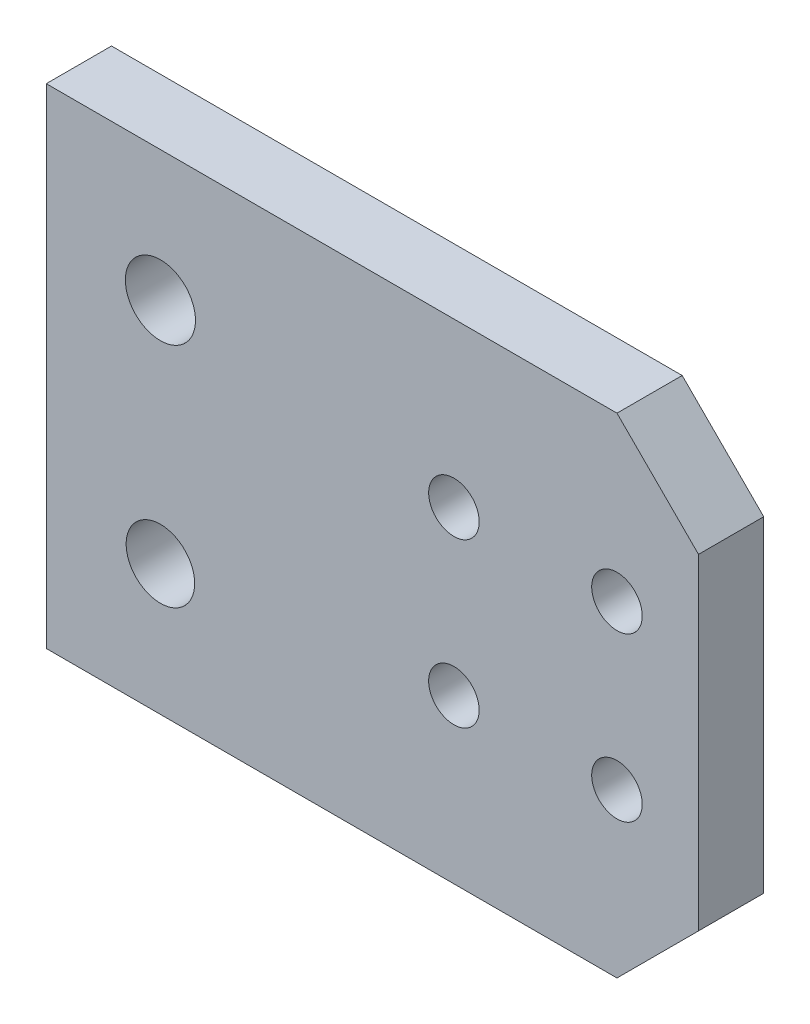
from build123d import *

# Parameters (mm, degrees)
SKETCH_1_W      = 40
SKETCH_1_H      = 30
SKETCH_1_R      = 2.15
SKETCH_1_R_2    = 2.1
SKETCH_1_R_3    = 1.55
EXTRUDE_1_DEPTH = 4
CHAMFER_1_SIZE  = 5


with BuildPart() as part:
    # 草图1 → 凸台-拉伸1 (new body)
    with BuildSketch(Plane.XY):
        with Locations((20, 15)):
            Rectangle(SKETCH_1_W, SKETCH_1_H)
        with Locations((7, 22)):
            Circle(SKETCH_1_R, mode=Mode.SUBTRACT)
        with Locations((7, 8)):
            Circle(SKETCH_1_R_2, mode=Mode.SUBTRACT)
        with Locations((35, 20)):
            Circle(SKETCH_1_R_3, mode=Mode.SUBTRACT)
        with Locations((25, 20)):
            Circle(SKETCH_1_R_3, mode=Mode.SUBTRACT)
        with Locations((25, 10)):
            Circle(SKETCH_1_R_3, mode=Mode.SUBTRACT)
        with Locations((35, 10)):
            Circle(SKETCH_1_R_3, mode=Mode.SUBTRACT)
    extrude(amount=EXTRUDE_1_DEPTH)

    # 倒角1
    chamfer_1_edges = [part.edges().sort_by_distance(p)[0] for p in [
        (40, 30, 2),
        (40, 0, 2),
    ]]
    chamfer(chamfer_1_edges, length=CHAMFER_1_SIZE)


solid = part.part
